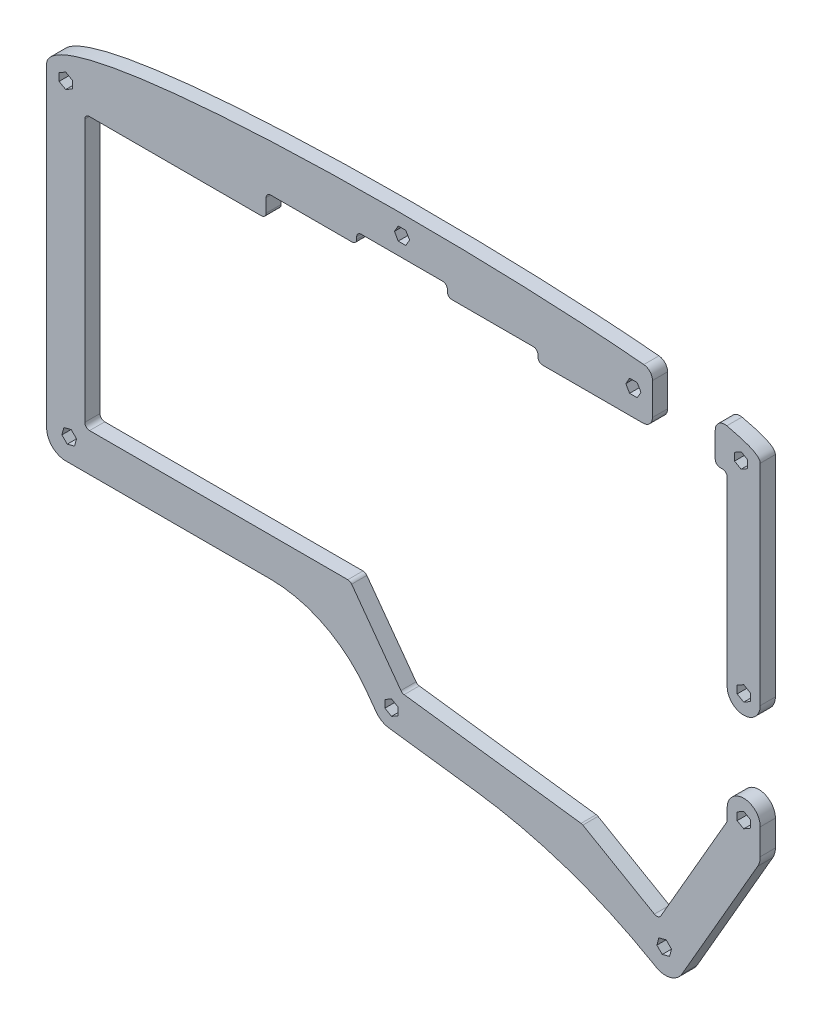
from build123d import *

# Parameters (mm, degrees)
BOSS_EXTRUDE1_DEPTH   = 3.175
BOSS_EXTRUDE1_2_DEPTH = 3.175


with BuildPart() as part:
    # Sketch2 → Boss-Extrude1 (new body)
    with BuildSketch(Plane.XY):
        with BuildLine():
            ThreePointArc((137.06050463, 54.781066453), (140.524945013, 51.31662607), (143.989385396, 54.781066453))
            Line((143.989385396, 54.781066453), (143.989385396, 98.790469349))
            add(Edge.make_bspline(
                [(136.989277174, 102.090560266), (139.210803765, 101.602958206), (142.710857876, 100.560879885), (143.989385396, 99.398436487), (143.989385396, 98.790469349)],
                knots=[0.869738458, 0.869738458, 0.869738458, 0.869738458, 0.934869229, 1, 1, 1, 1], degree=3))
            ThreePointArc((136.989277174, 102.090560266), (135.307018509, 101.69551432), (134.560504631, 100.13706235))
            Line((134.560504631, 100.13706235), (134.560504631, 94.790469349))
            ThreePointArc((134.560504631, 94.790469349), (134.853397849, 94.083362568), (135.560504631, 93.790469349))
            Line((135.560504631, 93.790469349), (136.06050463, 93.790469349))
            ThreePointArc((136.06050463, 93.790469349), (136.767611411, 93.497576131), (137.06050463, 92.790469349))
            Line((137.06050463, 92.790469349), (137.06050463, 54.781066453))
        make_face()
        Polygon((141.899945013, 54.487209833), (140.524945013, 53.693353213), (139.149945013, 54.487209833), (139.149945013, 56.074923073), (140.524945013, 56.868779693), (141.899945013, 56.074923073), align=None, mode=Mode.SUBTRACT)
        Polygon((141.364385396, 96.496612729), (139.989385396, 95.702756109), (138.614385396, 96.496612729), (138.614385396, 98.084325969), (139.989385396, 98.87818259), (141.364385396, 98.084325969), align=None, mode=Mode.SUBTRACT)
    extrude(amount=BOSS_EXTRUDE1_DEPTH)


with BuildPart() as body_2:
    # Sketch2 → Boss-Extrude1 2 (new body)
    with BuildSketch(Plane.XY):
        with BuildLine():
            Line((2.396591635, 35.425568858), (2.396591635, 90.463437274))
            ThreePointArc((2.396591635, 90.463437274), (2.678391323, 91.143761902), (3.358715952, 91.42556159))
            Line((3.358715952, 91.42556159), (39.432907616, 91.42556159))
            ThreePointArc((39.432907616, 91.42556159), (40.113232245, 91.707361278), (40.395031933, 92.387685907))
            Line((40.395031933, 92.387685907), (40.395031933, 95.208923218))
            ThreePointArc((40.395031933, 95.208923218), (40.676831621, 95.889247847), (41.357156249, 96.171047535))
            Line((41.357156249, 96.171047535), (58.434844112, 96.171047535))
            ThreePointArc((58.434844112, 96.171047535), (59.115168741, 96.452847223), (59.396968429, 97.133171852))
            Line((59.396968429, 97.133171852), (59.396968429, 97.587767164))
            ThreePointArc((59.396968429, 97.587767164), (59.678768117, 98.268091793), (60.359092745, 98.54989148))
            Line((60.359092745, 98.54989148), (77.434844109, 98.54989148))
            ThreePointArc((77.434844109, 98.54989148), (78.115168737, 98.268091793), (78.396968425, 97.587767164))
            Line((78.396968425, 97.587767164), (78.396968425, 97.137440751))
            ThreePointArc((78.396968425, 97.137440751), (78.678768113, 96.457116122), (79.359092742, 96.175316434))
            Line((79.359092742, 96.175316434), (96.436069121, 96.175316434))
            ThreePointArc((96.436069121, 96.175316434), (97.11639375, 95.893516746), (97.398193438, 95.213192117))
            Line((97.398193438, 95.213192117), (97.398193438, 94.752593666))
            ThreePointArc((97.398193438, 94.752593666), (97.679993126, 94.072269037), (98.360317754, 93.790469349))
            Line((98.360317754, 93.790469349), (119.399952063, 93.790469349))
            ThreePointArc((119.399952063, 93.790469349), (120.814165625, 94.376255787), (121.399952063, 95.790469349))
            Line((121.399952063, 95.790469349), (121.399952063, 102.513101085))
            ThreePointArc((121.399952063, 102.513101085), (120.878338657, 103.860087751), (119.585578985, 104.504468115))
            add(Edge.make_bspline(
                [(-5.603408365, 96.42556159), (-5.603408365, 103.460733083), (49.680782472, 108.062922152), (105.592674988, 105.808828214), (119.585578985, 104.504468115)],
                knots=[0, 0, 0, 0, 0.499912399, 0.744763163, 0.744763163, 0.744763163, 0.744763163], degree=3))
            Line((-5.603408365, 96.42556159), (-5.603408365, 30.425568858))
            ThreePointArc((-5.603408365, 30.425568858), (-4.43183549, 27.597141733), (-1.603408365, 26.425568858))
            Line((-1.603408365, 26.425568858), (41.26721418, 26.425568858))
            ThreePointArc((41.26721418, 26.425568858), (52.597121833, 23.710837368), (61.46641692, 16.156224264))
            Line((61.46641692, 16.156224264), (63.465114175, 13.41553894))
            ThreePointArc((63.465114175, 13.41553894), (64.657533725, 12.331421876), (66.181004174, 11.805863146))
            Line((66.181004174, 11.805863146), (84.187939735, 9.463477264))
            ThreePointArc((84.187939735, 9.463477264), (103.379739296, 5.009808001), (121.325879515, -3.120160731))
            Line((121.325879515, -3.120160731), (122.126093986, -3.582626958))
            ThreePointArc((122.126093986, -3.582626958), (125.162033535, -3.98331921), (127.591695632, -2.119391819))
            Line((127.591695632, -2.119391819), (143.453487011, 25.354036748))
            ThreePointArc((143.453487011, 25.354036748), (143.853088701, 26.318760568), (143.989385396, 27.354036748))
            Line((143.989385396, 27.354036748), (143.989385396, 32.781066453))
            ThreePointArc((143.989385396, 32.781066453), (140.524945013, 36.245506836), (137.06050463, 32.781066453))
            Line((137.06050463, 32.781066453), (137.06050463, 30.549015646))
            ThreePointArc((137.06050463, 30.549015646), (137.026430457, 30.2901966), (136.926530034, 30.049015646))
            Line((136.926530034, 30.049015646), (123.164575325, 6.212610879))
            ThreePointArc((123.164575325, 6.212610879), (122.557159801, 5.746629031), (121.798174914, 5.846802094))
            Line((121.798174914, 5.846802094), (106.806127324, 14.511123893))
            ThreePointArc((106.806127324, 14.511123893), (106.626665922, 14.59242358), (106.434747926, 14.636960273))
            Line((106.434747926, 14.636960273), (69.342490165, 19.462011189))
            ThreePointArc((69.342490165, 19.462011189), (68.961622553, 19.593400871), (68.663517666, 19.864430137))
            Line((68.663517666, 19.864430137), (58.344093061, 34.014795074))
            ThreePointArc((58.344093061, 34.014795074), (57.989321257, 34.316979598), (57.536124951, 34.425568858))
            Line((57.536124951, 34.425568858), (3.396591635, 34.425568858))
            ThreePointArc((3.396591635, 34.425568858), (2.689484854, 34.718462076), (2.396591635, 35.425568858))
        make_face()
        Polygon((68.062825633, 14.962927216), (66.678844193, 14.184834223), (65.313005174, 14.994350811), (65.331147595, 16.581960394), (66.715129035, 17.360053387), (68.080968054, 16.550536798), align=None, mode=Mode.SUBTRACT)
        Polygon((0.251507481, 30.035119106), (-1.282105743, 29.624188681), (-2.404788541, 30.74687148), (-1.993858117, 32.280484703), (-0.460244893, 32.691415128), (0.662437906, 31.568732329), align=None, mode=Mode.SUBTRACT)
        Polygon((125.393298838, 1.29225324), (124.982036337, -0.241270965), (123.448334168, -0.651869295), (122.325894499, 0.471056581), (122.737156999, 2.004580786), (124.270859169, 2.415179116), align=None, mode=Mode.SUBTRACT)
        Polygon((141.899945013, 31.487209833), (140.524945013, 30.693353213), (139.149945013, 31.487209833), (139.149945013, 33.074923073), (140.524945013, 33.868779693), (141.899945013, 33.074923073), align=None, mode=Mode.SUBTRACT)
        Polygon((-0.228408365, 94.63170497), (-1.603408365, 93.83784835), (-2.978408365, 94.63170497), (-2.978408365, 96.219418211), (-1.603408365, 97.013274831), (-0.228408365, 96.219418211), align=None, mode=Mode.SUBTRACT)
        Polygon((70.484681667, 102.54989148), (69.690825047, 101.17489148), (68.103111807, 101.17489148), (67.309255187, 102.54989148), (68.103111807, 103.92489148), (69.690825047, 103.92489148), align=None, mode=Mode.SUBTRACT)
        Polygon((118.987665303, 99.165469349), (118.193808683, 97.790469349), (116.606095443, 97.790469349), (115.812238823, 99.165469349), (116.606095443, 100.540469349), (118.193808683, 100.540469349), align=None, mode=Mode.SUBTRACT)
    extrude(amount=BOSS_EXTRUDE1_2_DEPTH)


solid = Compound([part.part, body_2.part])
